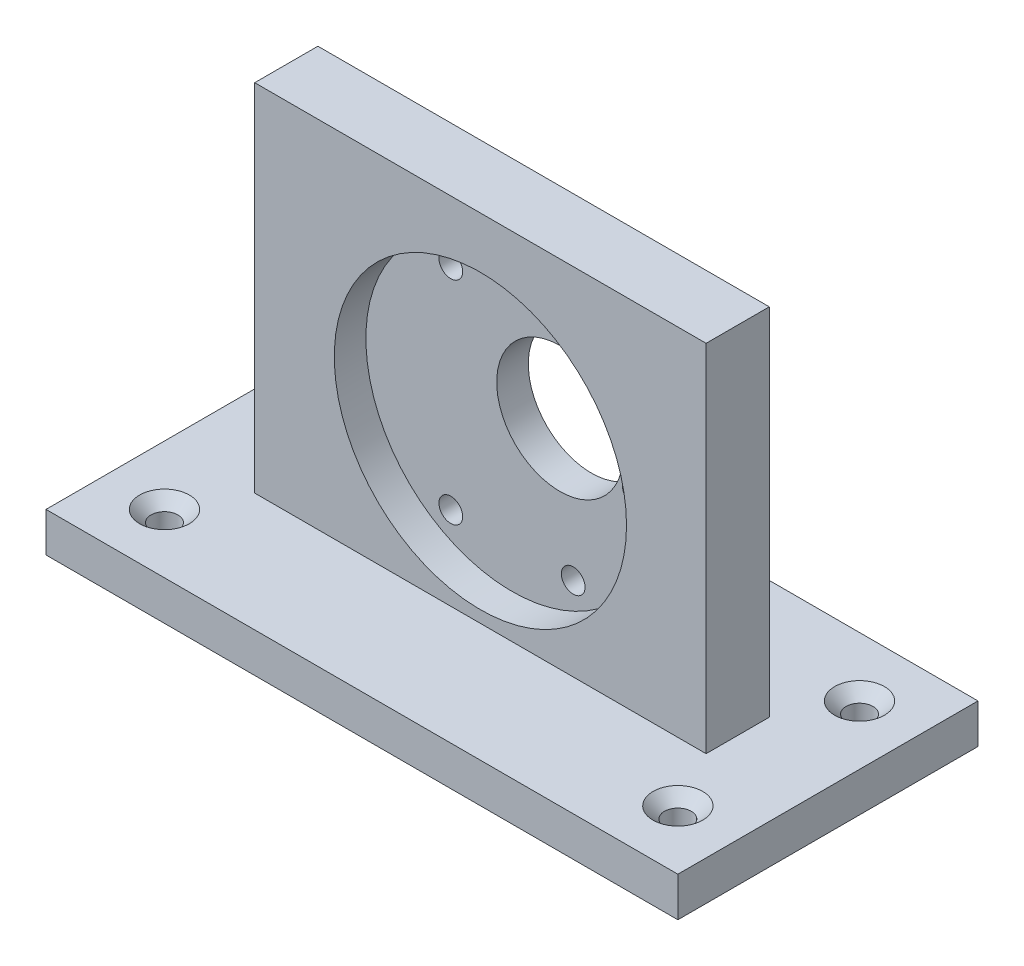
from build123d import *

# Parameters (mm, degrees)
SKETCH3_W                                       = 57.15
SKETCH3_H                                       = 50
BOSS_EXTRUDE1_DEPTH                             = 8
SKETCH3_3_R                                     = 1.5
SKETCH3_3_R_2                                   = 8
CUT_EXTRUDE2_DEPTH                              = 10
SKETCH4_R                                       = 18.5
CUT_EXTRUDE3_DEPTH                              = 4
BOSS_EXTRUDE2_DEPTH                             = 15
BOSS_EXTRUDE2_DEPTH_BACK                        = 23
SKETCH6_W                                       = 80
SKETCH6_H                                       = 5
CSK_FOR_M3_FLAT_HEAD_MACHINE_SCREW1_D           = 3.4
CSK_FOR_M3_FLAT_HEAD_MACHINE_SCREW1_CSINK_D     = 6.3
CSK_FOR_M3_FLAT_HEAD_MACHINE_SCREW1_CSINK_ANGLE = 90
SKETCH13_R                                      = 6.985
SKETCH13_R_2                                    = 5.08
BOSS_EXTRUDE4_DEPTH                             = 2.54
CUT_EXTRUDE6_REACH                              = 544.7
SKETCH16_R                                      = 1.7
CUT_EXTRUDE7_START                              = -3.175
SKETCH13_2_R                                    = 5.08
CUT_EXTRUDE7_DEPTH                              = 3.175


with BuildPart() as part:
    # Sketch3 → Boss-Extrude1 (new body)
    with BuildSketch(Plane.XY):
        with Locations((0, 25)):
            Rectangle(SKETCH3_W, SKETCH3_H)
    extrude(amount=BOSS_EXTRUDE1_DEPTH)

    # Sketch3<3> → Cut-Extrude2 (cut)
    with BuildSketch(Plane.XY):
        with Locations(Location((-7.75, 38.423393759, 0), (0, 0, 180))):
            Circle(SKETCH3_3_R)
        with Locations(Location((7.75, 38.423393759, 0), (0, 0, 180))):
            Circle(SKETCH3_3_R)
        with Locations(Location((-7.75, 11.576606241, 0), (0, 0, 180))):
            Circle(SKETCH3_3_R)
        with Locations(Location((7.75, 11.576606241, 0), (0, 0, 180))):
            Circle(SKETCH3_3_R)
        with Locations(Location((15.5, 25, 0), (0, 0, 180))):
            Circle(SKETCH3_3_R)
        with Locations(Location((6.062177825, 28.499999999, 0), (0, 0, 180))):
            Circle(SKETCH3_3_R_2)
    extrude(amount=CUT_EXTRUDE2_DEPTH, mode=Mode.SUBTRACT)

    # Sketch4 → Cut-Extrude3 (cut)
    with BuildSketch(Plane.XY.offset(8)):
        with Locations((0, 25)):
            Circle(SKETCH4_R)
    extrude(amount=-CUT_EXTRUDE3_DEPTH, mode=Mode.SUBTRACT)

    # Sketch6 → Boss-Extrude2 (add, two sides: drawn at the far end of the back side and taken through both)
    with BuildSketch(Plane.XY.offset(8).offset(-BOSS_EXTRUDE2_DEPTH_BACK)):
        with Locations((0, 2.5)):
            Rectangle(SKETCH6_W, SKETCH6_H)
    extrude(amount=BOSS_EXTRUDE2_DEPTH + BOSS_EXTRUDE2_DEPTH_BACK)

    # CSK for M3 Flat Head Machine Screw1 (through all)
    with Locations(Plane(origin=(0, 5, 0), x_dir=(1, 0, 0), z_dir=(0, 1, 0))):
        with Locations((-32.5, 7.5), (-32.5, -15.5), (32.5, -15.5), (32.5, 7.5)):
            CounterSinkHole(CSK_FOR_M3_FLAT_HEAD_MACHINE_SCREW1_D / 2, CSK_FOR_M3_FLAT_HEAD_MACHINE_SCREW1_CSINK_D / 2, counter_sink_angle=CSK_FOR_M3_FLAT_HEAD_MACHINE_SCREW1_CSINK_ANGLE)

    # Sketch13 → Boss-Extrude4 (add)
    with BuildSketch(Plane(origin=(0, 0, 0), x_dir=(-1, 0, 0), z_dir=(0, 0, -1))):
        with Locations((20.337822175, 28.499999999)):
            Circle(SKETCH13_R)
        with Locations((20.337822175, 28.499999999)):
            Circle(SKETCH13_R_2, mode=Mode.SUBTRACT)
    extrude(amount=BOSS_EXTRUDE4_DEPTH)

    # Sketch16 → Cut-Extrude6 (cut, up to next)
    with BuildSketch(Plane(origin=(-499.248949842, 16.821159134, -28.308871479), x_dir=(0.05083085086369645, -0.0009181581696577923, 0.9987068546806156), z_dir=(0.03609088653191216, 0.9993480899541042, -0.0009181581696584952)), mode=Mode.PRIVATE) as cut_extrude6_sk1:
        with Locations((44.5, 464.499999998)):
            Circle(SKETCH16_R)
    cut_extrude6_tool1 = extrude(cut_extrude6_sk1.sketch, amount=-CUT_EXTRUDE6_REACH, mode=Mode.PRIVATE) & part.part
    add(cut_extrude6_tool1.solids().sort_by_distance((-33.390455, 0.016084, -7.477347))[0], mode=Mode.SUBTRACT)

    # Sketch13<2> → Cut-Extrude7 (cut)
    with BuildSketch(Plane(origin=(0, 0, 0), x_dir=(-1, 0, 0), z_dir=(0, 0, -1)).offset(CUT_EXTRUDE7_START)):
        with Locations((20.337822175, 28.499999999)):
            Circle(SKETCH13_2_R)
    extrude(amount=CUT_EXTRUDE7_DEPTH, mode=Mode.SUBTRACT)


solid = part.part
